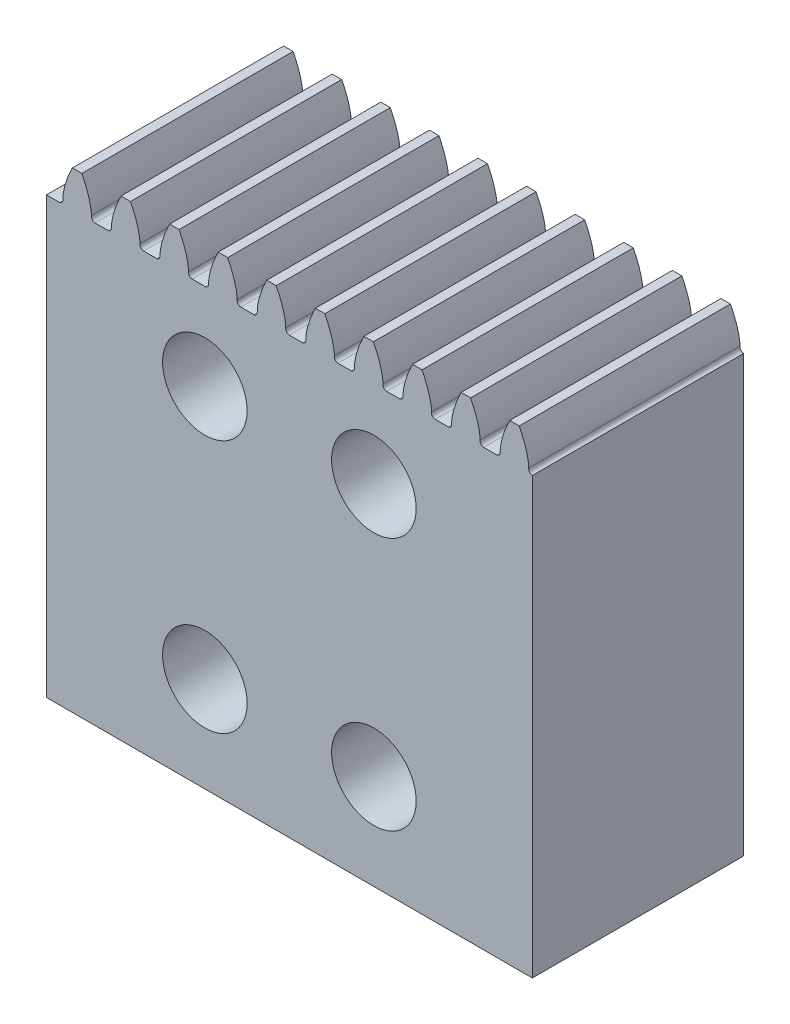
from build123d import *

# Parameters (mm, degrees)
SZKIC1_W                    = 23
SZKIC1_H                    = 17
SZKIC1_H_2                  = 1.6
DODANIE_WYCI_GNI_CIE1_DEPTH = 10
SZKIC2_R                    = 1.25
WYTNIJ_WYCI_GNI_CIE1_DEPTH  = 10
SZKIC3_R                    = 2
WYTNIJ_WYCI_GNI_CIE2_DEPTH  = 7
DODANIE_WYCI_GNI_CIE2_DEPTH = 10
SZYK_LINIOWY1_COUNT         = 10
SZYK_LINIOWY1_PITCH         = 2.3
SZKIC5_W                    = 23
SZKIC5_H                    = 10
DODANIE_WYCI_GNI_CIE3_DEPTH = 2


with BuildPart() as part:
    # Szkic1 → Dodanie-wyciągnięcie1 (new body)
    with BuildSketch(Plane.XY):
        Rectangle(SZKIC1_W, SZKIC1_H)
        with Locations((0, 9.3)):
            Rectangle(SZKIC1_W, SZKIC1_H_2)
    extrude(amount=DODANIE_WYCI_GNI_CIE1_DEPTH)

    # Szkic2 → Wytnij-wyciągnięcie1 (cut)
    with BuildSketch(Plane.XY.offset(10)):
        with Locations((-4, 6)):
            Circle(SZKIC2_R)
        with Locations((4, 6)):
            Circle(SZKIC2_R)
        with Locations((-4, -6)):
            Circle(SZKIC2_R)
        with Locations((4, -6)):
            Circle(SZKIC2_R)
    extrude(amount=-WYTNIJ_WYCI_GNI_CIE1_DEPTH, mode=Mode.SUBTRACT)

    # Szkic3 → Wytnij-wyciągnięcie2 (cut)
    with BuildSketch(Plane.XY.offset(10)):
        with Locations((-4, 6)):
            Circle(SZKIC3_R)
        with Locations((4, 6)):
            Circle(SZKIC3_R)
        with Locations((4, -6)):
            Circle(SZKIC3_R)
        with Locations((-4, -6)):
            Circle(SZKIC3_R)
    extrude(amount=-WYTNIJ_WYCI_GNI_CIE2_DEPTH, mode=Mode.SUBTRACT)

    # Szkic4 → Dodanie-wyciągnięcie2 (add)
    with BuildSketch(Plane.XY.offset(10)):
        with BuildLine():
            ThreePointArc((11.5, 10.1), (11.372943751, 10.163546485), (11.326913949, 10.297944042))
            Line((11.326913949, 10.297944042), (11.32854542, 10.325770314))
            add(Edge.make_bspline(
                [(11.32854542, 10.325770314), (11.328857247, 10.334102961), (11.329185769, 10.357487762), (11.327649978, 10.401726578), (11.322081988, 10.473795217), (11.310498187, 10.565330837), (11.290391379, 10.683083104), (11.260136791, 10.820872715), (11.220053355, 10.971065024), (11.169137494, 11.132866573), (11.111933501, 11.292665278), (11.04897128, 11.450372563), (10.982934355, 11.601323615), (10.930462181, 11.711995881), (10.8949251, 11.783608213), (10.877971017, 11.817070324)],
                knots=[0, 0, 0, 0, 0, 0.005376748, 0.015083688, 0.02853182, 0.046610139, 0.064854849, 0.092110525, 0.119476175, 0.146842495, 0.174208853, 0.201574955, 0.228941013, 0.253142236, 0.253142236, 0.253142236, 0.253142236, 0.253142236], degree=4))
            ThreePointArc((10.877971017, 11.817070324), (10.652458076, 11.818780314), (10.426950168, 11.816501365))
            add(Edge.make_bspline(
                [(10.426950168, 11.816501365), (10.410080563, 11.782996587), (10.374724271, 11.711294824), (10.322531488, 11.600490524), (10.256875619, 11.449373343), (10.194311489, 11.291507707), (10.137510847, 11.131565186), (10.087003369, 10.969635693), (10.047298992, 10.819342733), (10.01739214, 10.681477228), (9.997582482, 10.563674608), (9.98622966, 10.472110053), (9.980843515, 10.400027595), (9.979419342, 10.355785046), (9.979806863, 10.332401148), (9.980139712, 10.324069314)],
                knots=[0, 0, 0, 0, 0, 0.024201223, 0.051567281, 0.078933383, 0.106299741, 0.133666061, 0.161031712, 0.188287388, 0.206532097, 0.224610417, 0.238058549, 0.247765488, 0.253142236, 0.253142236, 0.253142236, 0.253142236, 0.253142236], degree=4))
            Line((9.980139712, 10.324069314), (9.981841383, 10.296247247))
            ThreePointArc((9.981841383, 10.296247247), (9.941668135, 10.168378983), (9.82639239, 10.1))
            Line((9.82639239, 10.1), (11.5, 10.1))
        make_face()
    dodanie_wyci_gni_cie2 = extrude(amount=-DODANIE_WYCI_GNI_CIE2_DEPTH)

    # Szyk liniowy1: Dodanie-wyciągnięcie2 ×10
    with Locations(*[(-i * SZYK_LINIOWY1_PITCH, 0, 0) for i in range(1, SZYK_LINIOWY1_COUNT)]):
        add(dodanie_wyci_gni_cie2)

    # Szkic5 → Dodanie-wyciągnięcie3 (add)
    with BuildSketch(Plane.XZ.offset(8.5)):
        with Locations((0, 5)):
            Rectangle(SZKIC5_W, SZKIC5_H)
    extrude(amount=DODANIE_WYCI_GNI_CIE3_DEPTH)


solid = part.part
